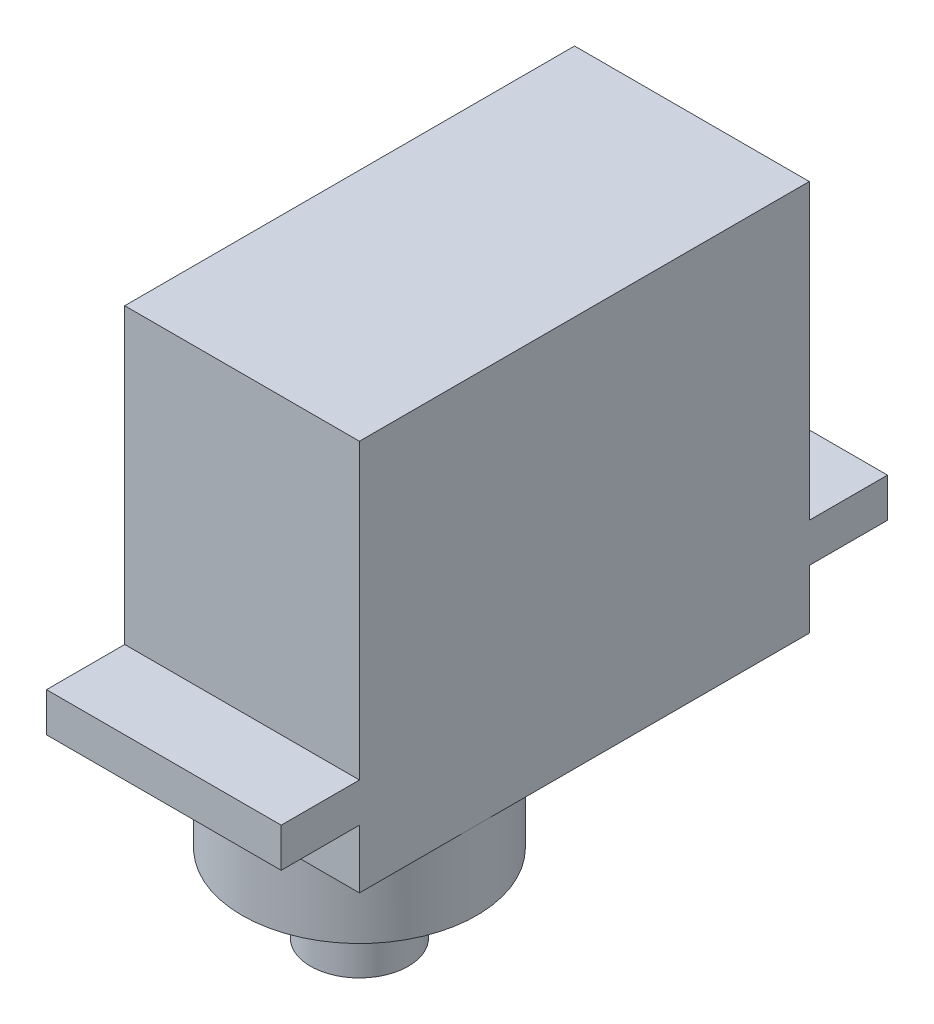
from build123d import *

# Parameters (mm, degrees)
EXTRUDE_2_DEPTH      = 15
EXTRUDE_2_DEPTH_BACK = 5
SKETCH_1_W           = 12
SKETCH_1_H           = 23
EXTRUDE_3_DEPTH      = 4
SKETCH_3_R           = 2.5
EXTRUDE_4_DEPTH      = 4
SKETCH_4_W           = 12
SKETCH_4_H           = 4
EXTRUDE_5_DEPTH      = 2


with BuildPart() as part:
    # 草图1 → 凸台-拉伸2 (new, two sides: drawn at the far end of the back side and taken through both)
    with BuildSketch(Plane(origin=(0, 0, 0), x_dir=(1, 0, 0), z_dir=(0, 1, 0)).offset(-EXTRUDE_2_DEPTH_BACK)):
        Rectangle(SKETCH_1_W, SKETCH_1_H)
    extrude(amount=EXTRUDE_2_DEPTH + EXTRUDE_2_DEPTH_BACK)

    # 草图2 → 凸台-拉伸3 (add)
    with BuildSketch(Plane.XZ.offset(5)):
        with BuildLine():
            ThreePointArc((1.495922385, -0.310526329), (0, 11.5), (-1.495922385, -0.310526329))
            ThreePointArc((-1.495922385, -0.310526329), (0, -2.636784312), (1.495922385, -0.310526329))
        make_face()
    extrude(amount=EXTRUDE_3_DEPTH)

    # 草图3 → 凸台-拉伸4 (add)
    with BuildSketch(Plane.XZ.offset(9)):
        with Locations(Location((0, 5.5, 0), (0, 0, 270))):
            Circle(SKETCH_3_R)
    extrude(amount=EXTRUDE_4_DEPTH)

    # 草图4 → 凸台-拉伸5 (add)
    with BuildSketch(Plane(origin=(0, 0, 0), x_dir=(1, 0, 0), z_dir=(0, 1, 0))):
        with Locations((0, -13.5)):
            Rectangle(SKETCH_4_W, SKETCH_4_H)
    extrude_5 = extrude(amount=-EXTRUDE_5_DEPTH)

    # 镜向1: 凸台-拉伸5 across plane
    add(extrude_5.mirror(Plane.XY))


solid = part.part
